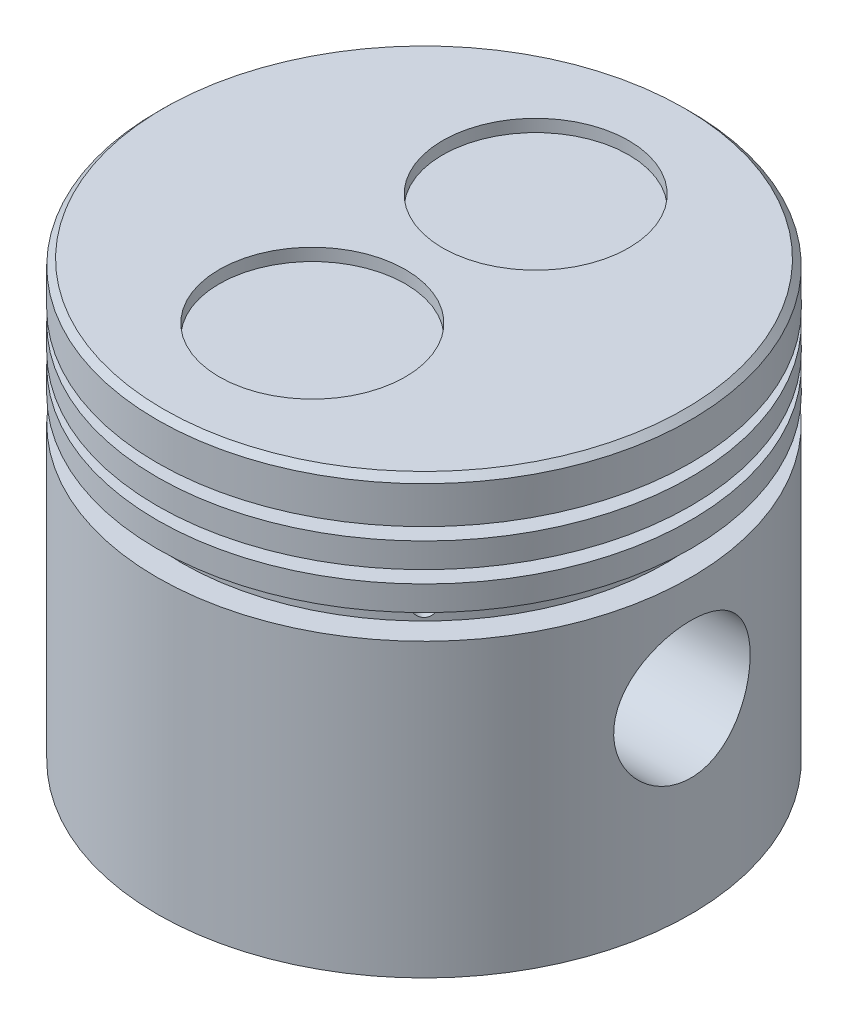
from build123d import *

# Parameters (mm, degrees)
SKETCH_1_R               = 43
EXTRUDE_1_DEPTH          = 70
SKETCH_2_W               = 5
SKETCH_2_H               = 2
SKETCH_2_H_2             = 4
SKETCH_3_R               = 37
CUT_EXTRUDE_1_DEPTH      = 58
EXTRUDE_2_REACH          = 106.757
EXTRUDE_2_END_RADIUS     = 37
SKETCH_4_R               = 15
SKETCH_5_R               = 11
CUT_EXTRUDE_2_DEPTH      = 87
SKETCH_6_R               = 15
CUT_EXTRUDE_3_DEPTH      = 2
SKETCH_7_R               = 1.5
CUT_EXTRUDE_4_DEPTH      = 3.5
PATTERN_CIRCULAR_1_COUNT = 8
CHAMFER_1_SIZE           = 1


with BuildPart() as part:
    # 草图1 → 凸台-拉伸1 (new body)
    with BuildSketch(Plane(origin=(0, 0, 0), x_dir=(1, 0, 0), z_dir=(0, 1, 0))):
        with Locations(Location((0, 0, 0), (0, 0, 270))):
            Circle(SKETCH_1_R)
    extrude(amount=-EXTRUDE_1_DEPTH)

    # 草图2 → 切除-旋转1 (revolve, cut)
    with BuildSketch(Plane.XY, mode=Mode.PRIVATE) as cut_revolve_1_sk:
        with Locations((41.5, -8)):
            Rectangle(SKETCH_2_W, SKETCH_2_H)
        with Locations((41.5, -14)):
            Rectangle(SKETCH_2_W, SKETCH_2_H)
        with Locations((41.5, -21)):
            Rectangle(SKETCH_2_W, SKETCH_2_H_2)
    revolve(cut_revolve_1_sk.sketch.rotate(Axis((0, 0, 0), (0, -1, 0)), 90), axis=Axis((0, 0, 0), (0, -1, 0)), mode=Mode.SUBTRACT)

    # 草图3 → 切除-拉伸1 (cut)
    with BuildSketch(Plane(origin=(0, -70, 0), x_dir=(1, 0, 0), z_dir=(0, 1, 0))):
        with Locations(Location((0, 0, 0), (0, 0, 90))):
            Circle(SKETCH_3_R)
    extrude(amount=CUT_EXTRUDE_1_DEPTH, mode=Mode.SUBTRACT)

    # 凸台-拉伸2: up to this cylinder (the profile starts inside it)
    extrude_2_end = Plane(origin=(0, -40, 0), z_dir=(0, -1, 0)) * Cylinder(EXTRUDE_2_END_RADIUS, 288.514, mode=Mode.PRIVATE)
    # 草图4 → 凸台-拉伸2 (add, up to the surface)
    with BuildSketch(Plane(origin=(22, 0, 0), x_dir=(0, 0, -1), z_dir=(1, 0, 0)), mode=Mode.PRIVATE) as extrude_2_sk1:
        with Locations(Location((0, -40, 0), (0, 0, 180))):
            Circle(SKETCH_4_R)
    extrude_2_tool1 = extrude(extrude_2_sk1.sketch, amount=EXTRUDE_2_REACH, mode=Mode.PRIVATE) & extrude_2_end
    extrude_2 = extrude_2_tool1.solids().sort_by_distance((22, -40, 0))[0]
    add(extrude_2)

    # 镜向1: 凸台-拉伸2 across plane
    add(extrude_2.mirror(Plane(origin=(0, 0, 0), x_dir=(0, 0, 1), z_dir=(1, 0, 0))))

    # 草图5 → 切除-拉伸2 (cut, symmetric)
    with BuildSketch(Plane(origin=(0, 0, 0), x_dir=(0, 0, -1), z_dir=(1, 0, 0))):
        with Locations((0, -40)):
            Circle(SKETCH_5_R)
    extrude(amount=CUT_EXTRUDE_2_DEPTH, both=True, mode=Mode.SUBTRACT)

    # 草图6 → 切除-拉伸3 (cut)
    with BuildSketch(Plane(origin=(0, 0, 0), x_dir=(1, 0, 0), z_dir=(0, 1, 0))):
        with Locations(Location((0, -18, 0), (0, 0, 270))):
            Circle(SKETCH_6_R)
        with Locations(Location((0, 18, 0), (0, 0, 270))):
            Circle(SKETCH_6_R)
    extrude(amount=-CUT_EXTRUDE_3_DEPTH, mode=Mode.SUBTRACT)

    # 草图7 → 切除-拉伸4 (cut)
    with BuildSketch(Plane(origin=(39, 0, 0), x_dir=(0, 0, -1), z_dir=(1, 0, 0))):
        with Locations((0, -21)):
            Circle(SKETCH_7_R)
    cut_extrude_4 = extrude(amount=-CUT_EXTRUDE_4_DEPTH, mode=Mode.SUBTRACT)

    # 阵列(圆周)1: 切除-拉伸4 ×8 about axis
    pattern_circular_1_axis = Axis((0, -73.5, 0), (0, 1, 0))
    for i in range(1, PATTERN_CIRCULAR_1_COUNT):
        add(cut_extrude_4.rotate(pattern_circular_1_axis, i * 360 / PATTERN_CIRCULAR_1_COUNT), mode=Mode.SUBTRACT)

    # 倒角1
    chamfer_1_edges = [part.edges().sort_by_distance(p)[0] for p in [
        (0, 0, -43),
    ]]
    chamfer(chamfer_1_edges, length=CHAMFER_1_SIZE)


solid = part.part
